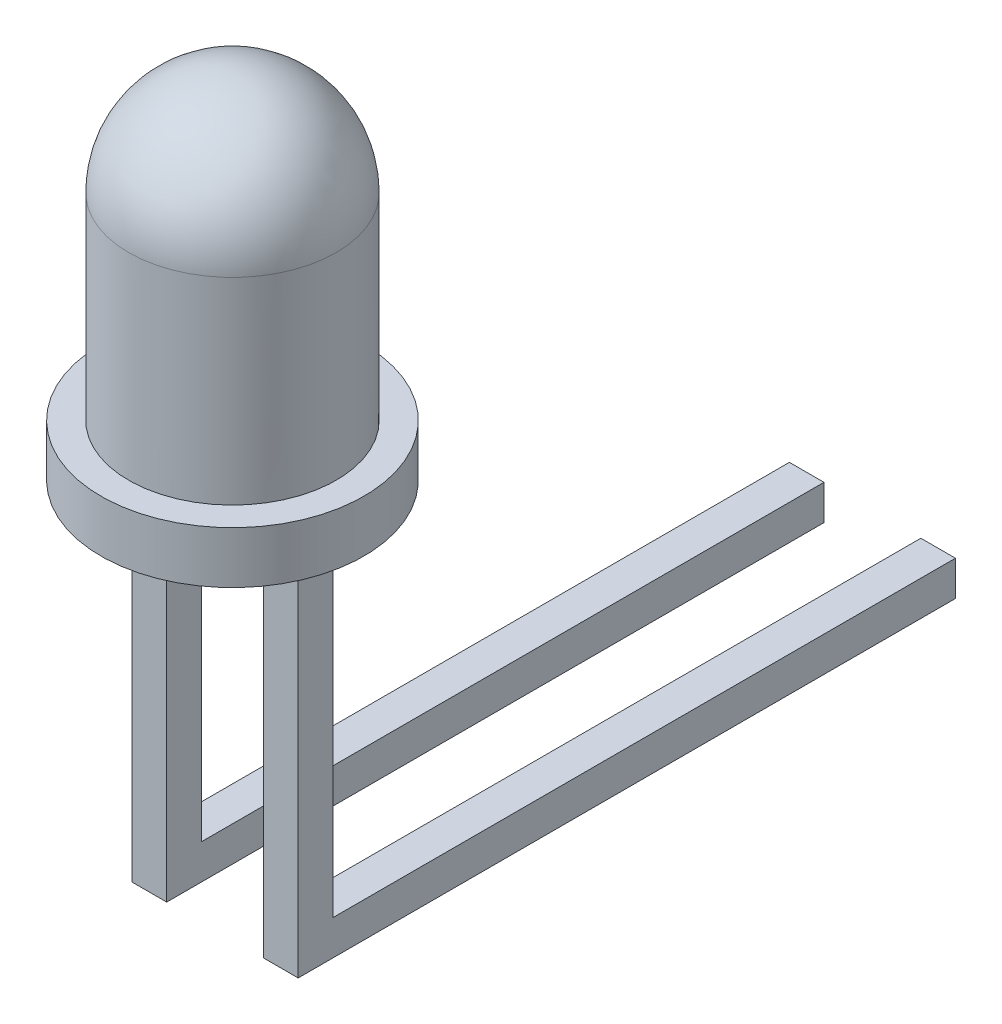
from build123d import *

# Parameters (mm, degrees)
SKICA2_W                = 0.5
SKICA2_H                = 5.505
P_IDAT_VYSUNUT_M1_DEPTH = 0.25
SKICA3_W                = 0.5
SKICA3_H                = 0.504797781
P_IDAT_VYSUNUT_M2_DEPTH = 9


with BuildPart() as part:
    # Skica1 → Rotovat1 (revolve)
    with BuildSketch(Plane.XY):
        with BuildLine():
            Line((-1.5, 6.066522781), (-1.5, 3.216522781))
            Line((-1.5, 3.216522781), (-1.9, 3.216522781))
            Line((-1.9, 3.216522781), (-1.9, 2.466522781))
            Line((-1.9, 2.466522781), (0, 2.466522781))
            Line((0, 2.466522781), (0, 7.566522781))
            ThreePointArc((0, 7.566522781), (-1.060660172, 7.127182953), (-1.5, 6.066522781))
        make_face()
    revolve(axis=Axis((0, 7.566522781, 0), (0, -1, 0)))

    # Skica2 → Přidat vysunutím1 (add, symmetric)
    with BuildSketch(Plane.XY):
        with Locations((0.95, -0.285977219)):
            Rectangle(SKICA2_W, SKICA2_H)
        with Locations((-0.95, -0.285977219)):
            Rectangle(SKICA2_W, SKICA2_H)
    extrude(amount=P_IDAT_VYSUNUT_M1_DEPTH, both=True)

    # Skica3 → Přidat vysunutím2 (add)
    with BuildSketch(Plane(origin=(0, 0, -0.25), x_dir=(-1, 0, 0), z_dir=(0, 0, -1))):
        with Locations((0.95, -2.786078329)):
            Rectangle(SKICA3_W, SKICA3_H)
        with Locations((-0.95, -2.786078329)):
            Rectangle(SKICA3_W, SKICA3_H)
    extrude(amount=P_IDAT_VYSUNUT_M2_DEPTH)


solid = part.part
